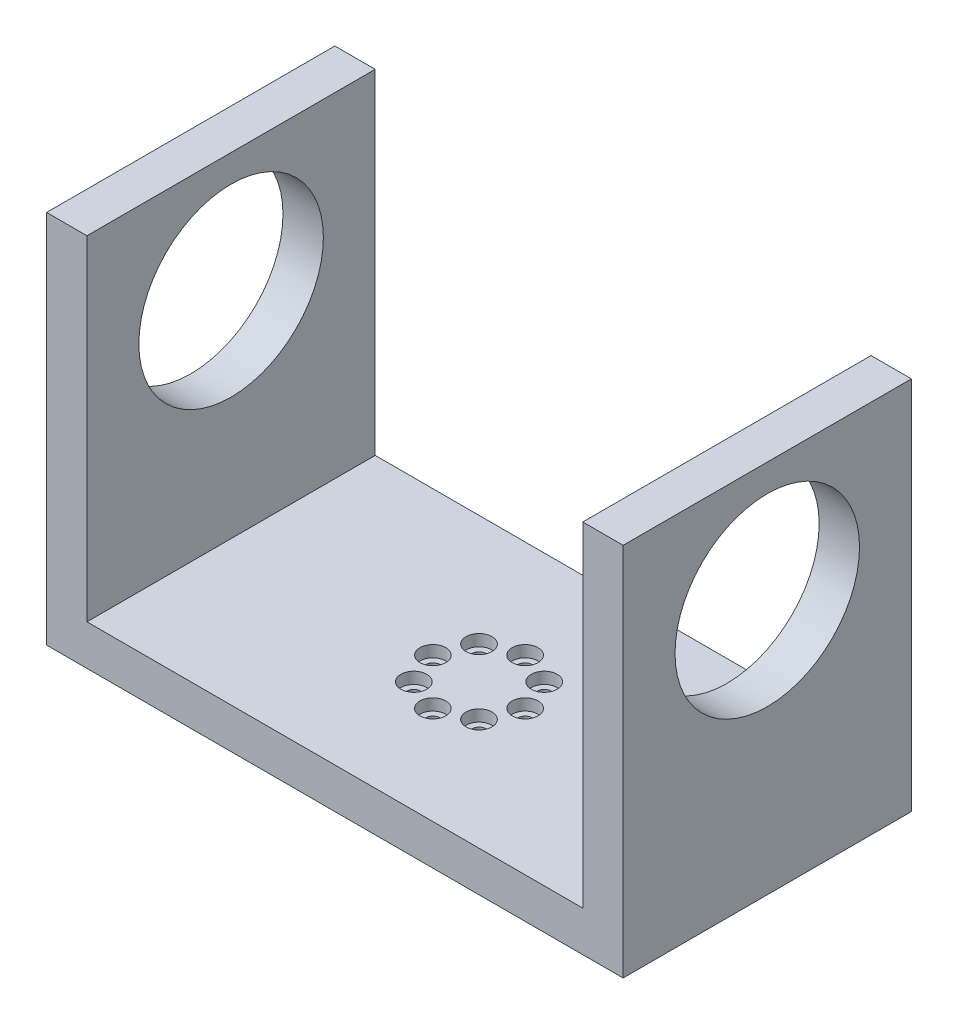
from build123d import *

# Parameters (mm, degrees)
BOSS_EXTRUDE1_DEPTH                             = 50
CBORE_FOR_M2_SOCKET_HEAD_CAP_SCREW1_D           = 2.4
CBORE_FOR_M2_SOCKET_HEAD_CAP_SCREW1_CBORE_D     = 4.5
CBORE_FOR_M2_SOCKET_HEAD_CAP_SCREW1_CBORE_DEPTH = 2
SKETCH7_R                                       = 4
CUT_EXTRUDE2_DEPTH                              = 2.2
SKETCH8_R                                       = 2.5
CUT_EXTRUDE3_DEPTH                              = 3
CUT_EXTRUDE4_DEPTH                              = 124.991935222
CUT_EXTRUDE4_DEPTH_BACK                         = 124.991935222
SKETCH3_R                                       = 16


with BuildPart() as part:
    # Sketch1 → Boss-Extrude1 (new body)
    with BuildSketch(Plane.XY):
        Polygon((-50, 0), (50, 0), (50, 65), (43, 65), (43, 7), (-43, 7), (-43, 65), (-50, 65), align=None)
    extrude(amount=BOSS_EXTRUDE1_DEPTH)

    # CBORE for M2 Socket Head Cap Screw1 (through all)
    with Locations(Plane(origin=(0, 7, 17), x_dir=(0, 0, 1), z_dir=(0, 1, 0))):
        with Locations((0, 0), (2.343145751, 5.656854249), (8, 8), (13.656854249, 5.656854249), (16, 0), (13.656854249, -5.656854249), (8, -8), (2.343145751, -5.656854249)):
            CounterBoreHole(CBORE_FOR_M2_SOCKET_HEAD_CAP_SCREW1_D / 2, CBORE_FOR_M2_SOCKET_HEAD_CAP_SCREW1_CBORE_D / 2, CBORE_FOR_M2_SOCKET_HEAD_CAP_SCREW1_CBORE_DEPTH)

    # Sketch7 → Cut-Extrude2 (cut)
    with BuildSketch(Plane.XZ):
        with Locations(Location((0, 25, 0), (0, 0, 270))):
            Circle(SKETCH7_R)
    extrude(amount=-CUT_EXTRUDE2_DEPTH, mode=Mode.SUBTRACT)

    # Sketch8 → Cut-Extrude3 (cut)
    with BuildSketch(Plane.XZ.offset(-2.2)):
        with Locations(Location((0, 25, 0), (0, 0, 270))):
            Circle(SKETCH8_R)
    extrude(amount=-CUT_EXTRUDE3_DEPTH, mode=Mode.SUBTRACT)

    # Sketch3 → Cut-Extrude4 (cut, two sides: drawn at the far end of the back side and taken through both)
    with BuildSketch(Plane(origin=(43, 0, 0), x_dir=(0, 0, -1), z_dir=(1, 0, 0)).offset(-CUT_EXTRUDE4_DEPTH_BACK)):
        with Locations(Location((-25, 44.25, 0), (0, 0, 90))):
            Circle(SKETCH3_R)
    extrude(amount=CUT_EXTRUDE4_DEPTH + CUT_EXTRUDE4_DEPTH_BACK, mode=Mode.SUBTRACT)


solid = part.part
